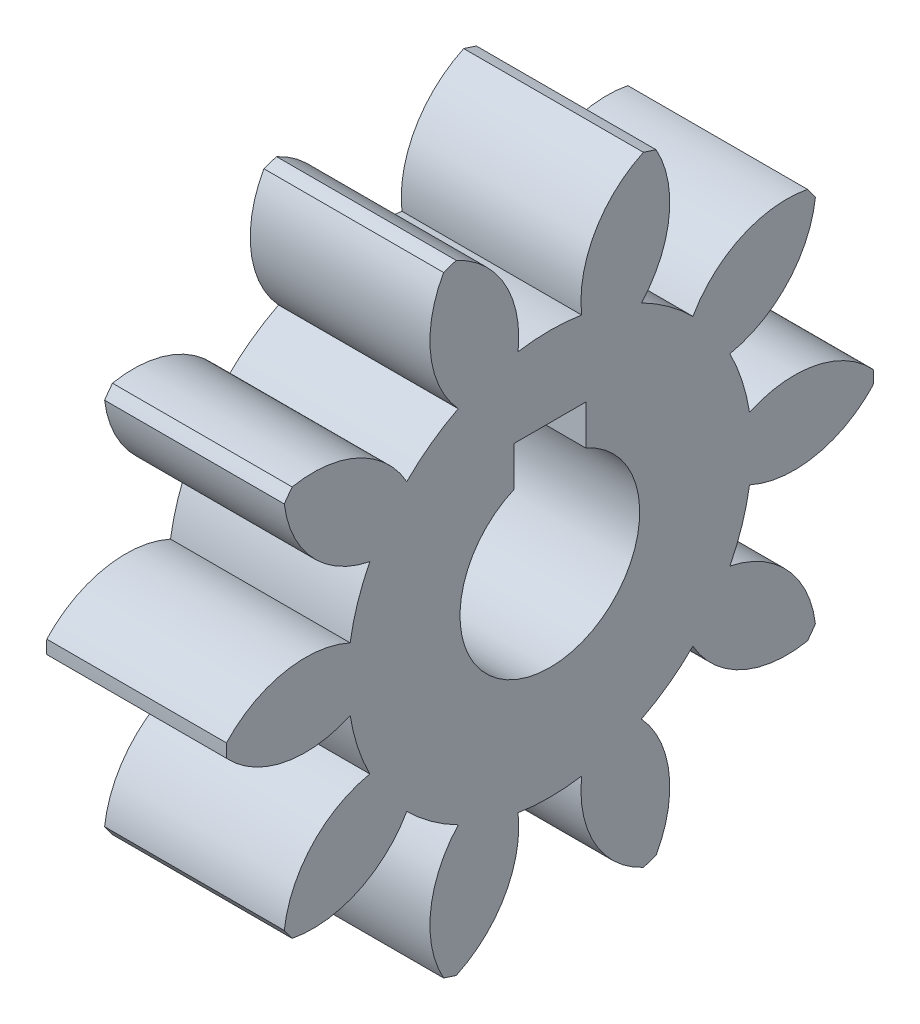
from build123d import *

# Parameters (mm, degrees)
BASPROSKE_W     = 10
BASPROSKE_H     = 18
TOOTHCUT_DEPTH  = 28.349588662
TEETHCUTS_COUNT = 10
TEETHCUTS_ANGLE = 324
BORSKE_R        = 5
BORE_DEPTH      = 50.0000508
KEYSKE_W        = 4
KEYSKE_H        = 6.8
KEYWAY_DEPTH    = 50.0000508


with BuildPart() as part:
    # BasProSke → Base-Revolve (revolve)
    with BuildSketch(Plane(origin=(0, 0, 0), x_dir=(1, 0, 0), z_dir=(0, 1, 0)), mode=Mode.PRIVATE) as base_revolve_sk:
        with Locations((5, 9)):
            Rectangle(BASPROSKE_W, BASPROSKE_H)
    revolve(base_revolve_sk.sketch.rotate(Axis((-10, 0, 0), (1, 0, 0)), 180), axis=Axis((-10, 0, 0), (1, 0, 0)))

    # TooCutSke → ToothCut (cut, through all)
    with BuildSketch(Plane(origin=(0, 0, 0), x_dir=(0, 0, -1), z_dir=(1, 0, 0))):
        with BuildLine():
            ThreePointArc((1.768949054, 11.109042274), (0, 11.249), (-1.768949054, 11.109042274))
            ThreePointArc((-1.768949054, 11.109042274), (-2.508977513, 14.741789417), (-5.242576524, 17.246171649))
            ThreePointArc((-5.242576524, 17.246171649), (0, 18.0254), (5.242576524, 17.246171649))
            ThreePointArc((5.242576524, 17.246171649), (2.508977513, 14.741789417), (1.768949054, 11.109042274))
        make_face()
    toothcut = extrude(amount=TOOTHCUT_DEPTH, mode=Mode.SUBTRACT)

    # TeethCuts: ToothCut ×10 about axis
    teethcuts_axis = Axis((-10, 0, 0), (1, 0, 0))
    for i in range(1, TEETHCUTS_COUNT):
        add(toothcut.rotate(teethcuts_axis, i * TEETHCUTS_ANGLE / (TEETHCUTS_COUNT - 1)), mode=Mode.SUBTRACT)

    # BorSke → Bore (cut, symmetric)
    with BuildSketch(Plane(origin=(0, 0, 0), x_dir=(0, 0, -1), z_dir=(1, 0, 0))):
        with Locations(Location((0, 0, 0), (0, 0, 180))):
            Circle(BORSKE_R)
    extrude(amount=BORE_DEPTH, both=True, mode=Mode.SUBTRACT)

    # KeySke → Keyway (cut, symmetric)
    with BuildSketch(Plane(origin=(0, 0, 0), x_dir=(0, 0, -1), z_dir=(1, 0, 0))):
        with Locations((0, 3.4)):
            Rectangle(KEYSKE_W, KEYSKE_H)
    extrude(amount=KEYWAY_DEPTH, both=True, mode=Mode.SUBTRACT)


solid = part.part
